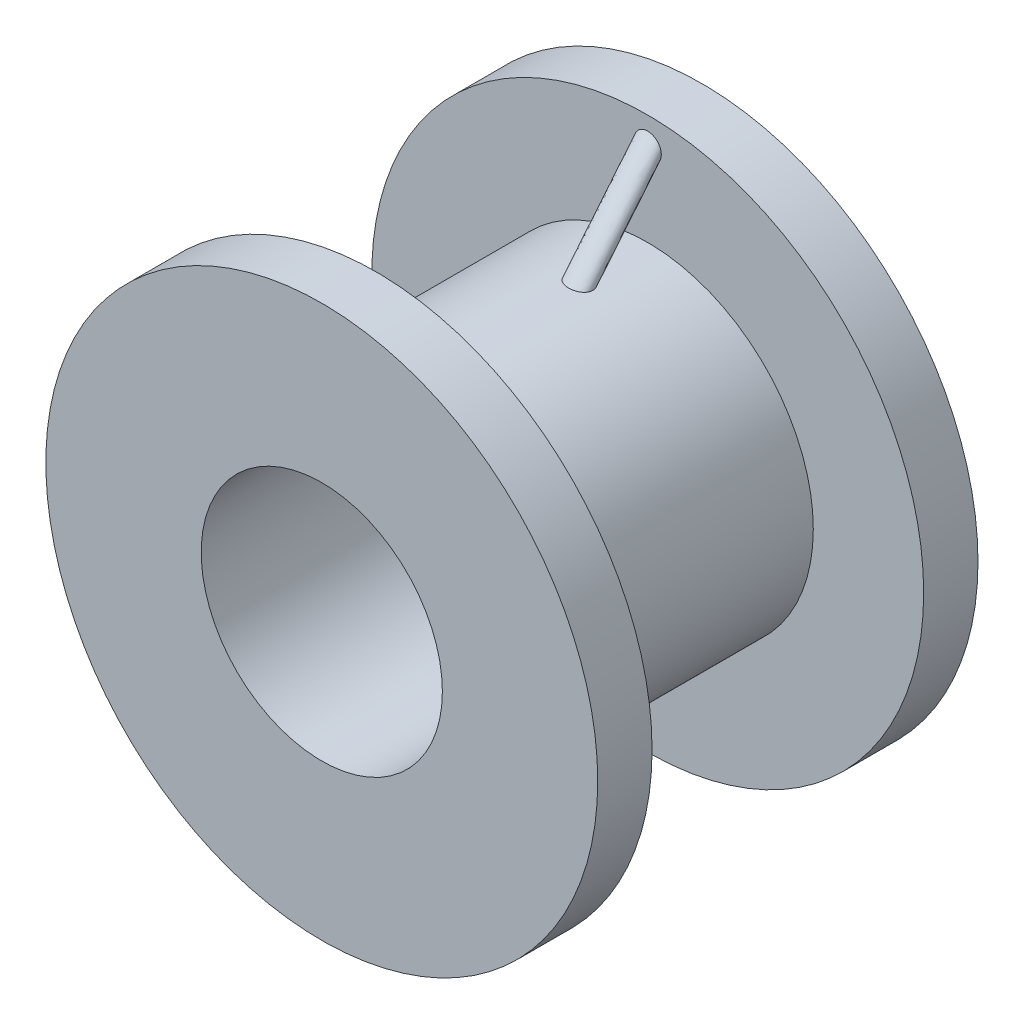
from build123d import *

# Parameters (mm, degrees)
SKETCH1_R           = 15.24
SKETCH1_R_2         = 11.1
BOSS_EXTRUDE1_DEPTH = 30
SKETCH3_R           = 25.4
SKETCH3_R_2         = 5.1
SKETCH3_R_3         = 1.5
BOSS_EXTRUDE2_DEPTH = 5
SKETCH4_R           = 25.4
SKETCH4_R_2         = 11.1
BOSS_EXTRUDE3_DEPTH = 5
SKETCH5_R           = 11.1
CUT_EXTRUDE1_DEPTH  = 1.2
SKETCH10_R          = 1.25


with BuildPart() as part:
    # Sketch1 → Boss-Extrude1 (new body)
    with BuildSketch(Plane.XY):
        Circle(SKETCH1_R)
        Circle(SKETCH1_R_2, mode=Mode.SUBTRACT)
    extrude(amount=BOSS_EXTRUDE1_DEPTH)

    # Sketch3 → Boss-Extrude2 (add)
    with BuildSketch(Plane.XY):
        Circle(SKETCH3_R)
        Circle(SKETCH3_R_2, mode=Mode.SUBTRACT)
        with Locations((0, 8)):
            Circle(SKETCH3_R_3, mode=Mode.SUBTRACT)
        with Locations((8, 0)):
            Circle(SKETCH3_R_3, mode=Mode.SUBTRACT)
        with Locations((0, -8)):
            Circle(SKETCH3_R_3, mode=Mode.SUBTRACT)
        with Locations((-8, 0)):
            Circle(SKETCH3_R_3, mode=Mode.SUBTRACT)
    extrude(amount=BOSS_EXTRUDE2_DEPTH)

    # Sketch4 → Boss-Extrude3 (add)
    with BuildSketch(Plane.XY.offset(30)):
        Circle(SKETCH4_R)
        Circle(SKETCH4_R_2, mode=Mode.SUBTRACT)
    extrude(amount=BOSS_EXTRUDE3_DEPTH)

    # Sketch5 → Cut-Extrude1 (cut)
    with BuildSketch(Plane(origin=(0, 0, 0), x_dir=(-1, 0, 0), z_dir=(0, 0, -1))):
        with Locations(Location((0, 0, 0), (0, 0, 180))):
            Circle(SKETCH5_R)
    extrude(amount=-CUT_EXTRUDE1_DEPTH, mode=Mode.SUBTRACT)

    # Sweep3: sweep along a path in Sketch14
    with BuildLine(Plane(origin=(0, 0, 0), x_dir=(0, 0, -1), z_dir=(1, 0, 0))) as sweep3_path:
        Line((-5, 22.86), (-12.988321423, 13.120638521))
    # Sketch10 → Sweep3 (sweep)
    with BuildSketch(Plane.XY.offset(5)):
        with Locations((0, 22.86)):
            Circle(SKETCH10_R)
    sweep(path=sweep3_path.line)


solid = part.part
